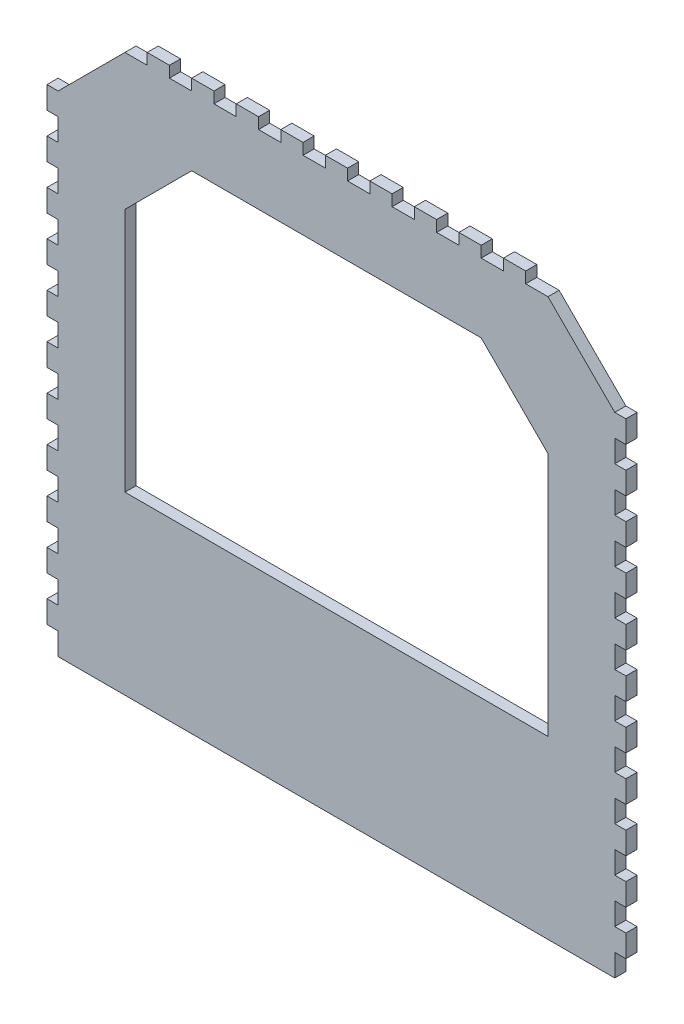
from build123d import *

# Parameters (mm, degrees)
AUFSATZ_LINEAR_AUSTRAGEN1_DEPTH = 5


with BuildPart() as part:
    # Skizze1 → Aufsatz-Linear austragen1 (new body)
    with BuildSketch(Plane.XY):
        Polygon((460.89618142, 291.663856447), (470.89618142, 291.663856447), (470.89618142, 296.663856447), (480.89618142, 296.663856447), (480.89618142, 291.663856447), (490.89618142, 291.663856447), (490.89618142, 296.663856447), (500.89618142, 296.663856447), (500.89618142, 291.663856447), (510.89618142, 291.663856447), (510.89618142, 296.663856447), (520.89618142, 296.663856447), (520.89618142, 291.663856447), (530.89618142, 291.663856447), (530.89618142, 296.663856447), (540.89618142, 296.663856447), (540.89618142, 291.663856447), (550.89618142, 291.663856447), (550.89618142, 296.663856447), (560.89618142, 296.663856447), (560.89618142, 291.663856447), (570.89618142, 291.663856447), (570.89618142, 296.663856447), (580.89618142, 296.663856447), (580.89618142, 291.663856447), (590.89618142, 291.663856447), (590.89618142, 296.663856447), (600.89618142, 296.663856447), (600.89618142, 291.663856447), (610.89618142, 291.663856447), (610.89618142, 296.663856447), (620.89618142, 296.663856447), (620.89618142, 291.663856447), (630.89618142, 291.663856447), (630.89618142, 296.663856447), (640.89618142, 296.663856447), (640.89618142, 291.663856447), (650.89618142, 291.663856447), (680.89618142, 261.663856447), (685.89618142, 261.663856447), (685.89618142, 251.663856447), (680.89618142, 251.663856447), (680.89618142, 241.663856447), (685.89618142, 241.663856447), (685.89618142, 231.663856447), (680.89618142, 231.663856447), (680.89618142, 221.663856447), (685.89618142, 221.663856447), (685.89618142, 211.663856447), (680.89618142, 211.663856447), (680.89618142, 201.663856447), (685.89618142, 201.663856447), (685.89618142, 191.663856447), (680.89618142, 191.663856447), (680.89618142, 181.663856447), (685.89618142, 181.663856447), (685.89618142, 171.663856447), (680.89618142, 171.663856447), (680.89618142, 161.663856447), (685.89618142, 161.663856447), (685.89618142, 151.663856447), (680.89618142, 151.663856447), (680.89618142, 141.663856447), (685.89618142, 141.663856447), (685.89618142, 131.663856447), (680.89618142, 131.663856447), (680.89618142, 121.663856447), (685.89618142, 121.663856447), (685.89618142, 111.663856447), (680.89618142, 111.663856447), (680.89618142, 101.663856447), (685.89618142, 101.663856447), (685.89618142, 91.663856447), (680.89618142, 91.663856447), (680.89618142, 81.663856447), (685.89618142, 81.663856447), (685.89618142, 71.663856447), (680.89618142, 71.663856447), (680.89618142, 61.663856447), (685.89618142, 61.663856447), (685.89618142, 51.663856447), (680.89618142, 51.663856447), (680.89618142, 41.663856447), (430.89618142, 41.663856447), (430.89618142, 51.663856447), (425.89618142, 51.663856447), (425.89618142, 61.663856447), (430.89618142, 61.663856447), (430.89618142, 71.663856447), (425.89618142, 71.663856447), (425.89618142, 81.663856447), (430.89618142, 81.663856447), (430.89618142, 91.663856447), (425.89618142, 91.663856447), (425.89618142, 101.663856447), (430.89618142, 101.663856447), (430.89618142, 111.663856447), (425.89618142, 111.663856447), (425.89618142, 121.663856447), (430.89618142, 121.663856447), (430.89618142, 131.663856447), (425.89618142, 131.663856447), (425.89618142, 141.663856447), (430.89618142, 141.663856447), (430.89618142, 151.663856447), (425.89618142, 151.663856447), (425.89618142, 161.663856447), (430.89618142, 161.663856447), (430.89618142, 171.663856447), (425.89618142, 171.663856447), (425.89618142, 181.663856447), (430.89618142, 181.663856447), (430.89618142, 191.663856447), (425.89618142, 191.663856447), (425.89618142, 201.663856447), (430.89618142, 201.663856447), (430.89618142, 211.663856447), (425.89618142, 211.663856447), (425.89618142, 221.663856447), (430.89618142, 221.663856447), (430.89618142, 231.663856447), (425.89618142, 231.663856447), (425.89618142, 241.663856447), (430.89618142, 241.663856447), (430.89618142, 251.663856447), (425.89618142, 251.663856447), (425.89618142, 261.663856447), (430.89618142, 261.663856447), align=None)
        Polygon((490.89618142, 260.635021844), (620.89618142, 260.635021844), (650.89618142, 230.635021844), (650.89618142, 120.635021844), (460.89618142, 120.635021844), (460.89618142, 230.635021844), align=None, mode=Mode.SUBTRACT)
    extrude(amount=AUFSATZ_LINEAR_AUSTRAGEN1_DEPTH)


solid = part.part
